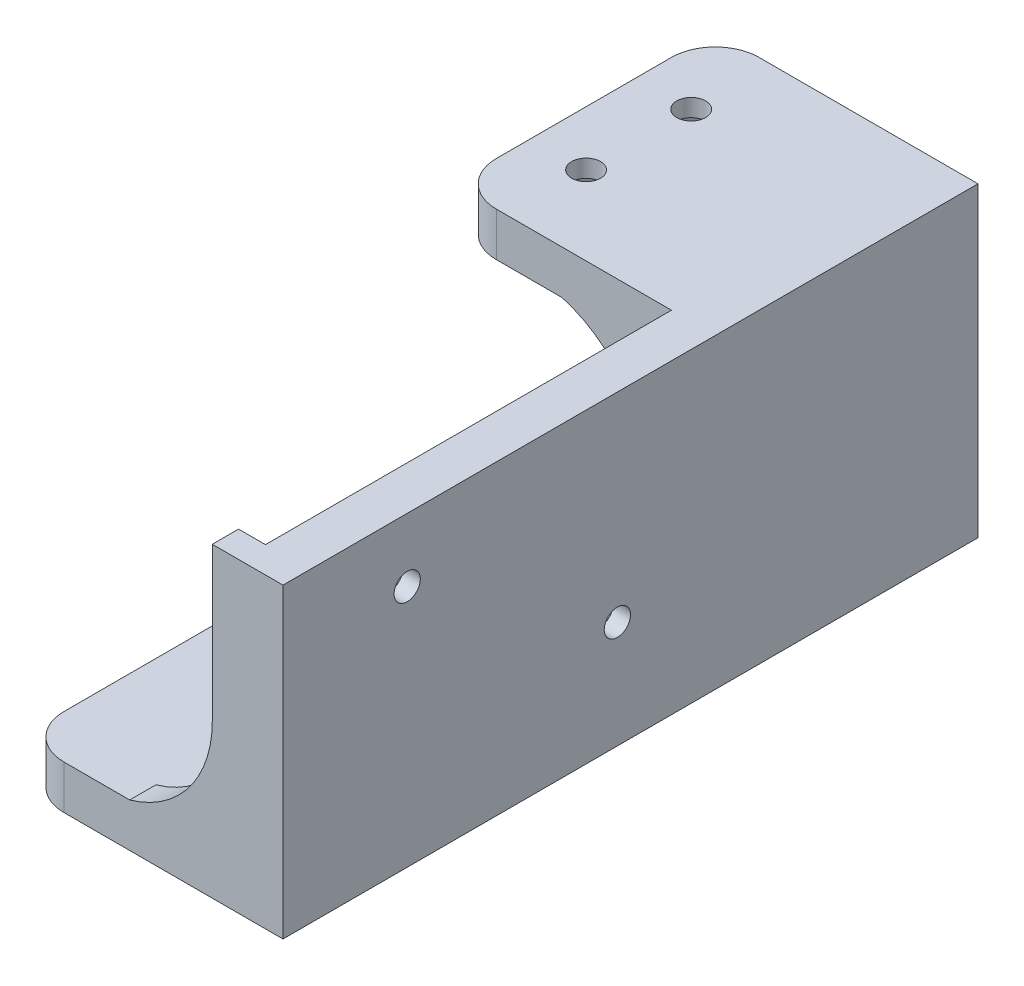
from build123d import *

# Parameters (mm, degrees)
EXTRUDE_1_DEPTH     = 30
EXTRUDE_2_DEPTH     = 3
CUT_EXTRUDE_1_DEPTH = 3
CUT_EXTRUDE_START   = -17
SKETCH_4_R          = 1.65
CUT_EXTRUDE_2_DEPTH = 76
CUT_EXTRUDE_3_DEPTH = 3
FILLET_1_R          = 5
EXTRUDE_3_DEPTH     = 49.36
EXTRUDE_4_DEPTH     = 3
CUT_EXTRUDE_4_DEPTH = 3
SKETCH_10_R         = 1.5
CUT_EXTRUDE_5_DEPTH = 12
FILLET_2_R          = 5
CUT_EXTRUDE_6_DEPTH = 3
SKETCH_12_R         = 1.65
CUT_EXTRUDE_7_DEPTH = 15


with BuildPart() as part:
    # Эскиз1 → Бобышка-Вытянуть1 (new body)
    with BuildSketch(Plane.XY):
        Polygon((0, 0), (30, 0), (30, 35), (0, 35), (0, 30), (25, 30), (25, 5), (0, 5), align=None)
    extrude(amount=EXTRUDE_1_DEPTH)

    # Эскиз2 → Бобышка-Вытянуть2 (add)
    with BuildSketch(Plane.XY.offset(30)):
        with BuildLine():
            Line((12.5, 30), (25, 30))
            Line((25, 30), (25, 5))
            Line((25, 5), (12.5, 5))
            ThreePointArc((12.5, 5), (21.929285786, 17.5), (12.5, 30))
        make_face()
    extrude_2 = extrude(amount=-EXTRUDE_2_DEPTH)

    # Зеркальное отражение1: Бобышка-Вытянуть2 across plane
    add(extrude_2.mirror(Plane.XY.offset(15)))

    # Эскиз3 → Вырез-Вытянуть1 (cut)
    with BuildSketch(Plane(origin=(0, 5, 0), x_dir=(1, 0, 0), z_dir=(0, 1, 0))):
        Polygon((4.517949192, -24), (2.785898385, -21), (4.517949192, -18), (7.982050808, -18), (9.714101615, -21), (7.982050808, -24), align=None)
        Polygon((2.785898385, -9), (4.517949192, -12), (7.982050808, -12), (9.714101615, -9), (7.982050808, -6), (4.517949192, -6), align=None)
    extrude(amount=-CUT_EXTRUDE_1_DEPTH, mode=Mode.SUBTRACT)

    # Эскиз4 → Вырез-Вытянуть2 (cut)
    with BuildSketch(Plane(origin=(0, 2, 0), x_dir=(1, 0, 0), z_dir=(0, 1, 0)).offset(CUT_EXTRUDE_START)):
        with Locations(Location((6.25, -21, 0), (0, 0, 90))):
            Circle(SKETCH_4_R)
    cut_extrude_2 = extrude(amount=CUT_EXTRUDE_2_DEPTH, mode=Mode.SUBTRACT)

    # Зеркальное отражение2: Вырез-Вытянуть2 across plane
    add(cut_extrude_2.mirror(Plane.XY.offset(15)), mode=Mode.SUBTRACT)

    # Эскиз5 → Вырез-Вытянуть3 (cut)
    with BuildSketch(Plane.XZ.offset(-30)):
        Polygon((9.714101615, 21), (7.982050808, 24), (4.517949192, 24), (2.785898385, 21), (4.517949192, 18), (7.982050808, 18), align=None)
    cut_extrude_3 = extrude(amount=-CUT_EXTRUDE_3_DEPTH, mode=Mode.SUBTRACT)

    # Зеркальное отражение3: Вырез-Вытянуть3 across plane
    add(cut_extrude_3.mirror(Plane.XY.offset(15)), mode=Mode.SUBTRACT)

    # Скругление1
    fillet_1_edges = [part.edges().sort_by_distance(p)[0] for p in [
        (0, 2.5, 0),
        (0, 32.5, 30),
        (0, 32.5, 0),
    ]]
    fillet(fillet_1_edges, radius=FILLET_1_R)

    # Эскиз7 → Бобышка-Вытянуть3 (add)
    with BuildSketch(Plane.XY.offset(30)):
        Polygon((0, 0), (30, 0), (30, 35), (25, 35), (25, 5), (0, 5), align=None)
    extrude(amount=EXTRUDE_3_DEPTH)

    # Эскиз8 → Бобышка-Вытянуть4 (add)
    with BuildSketch(Plane.XY.offset(79.36)):
        with BuildLine():
            Line((21.929285786, 17.5), (21.929285786, 35))
            Line((21.929285786, 35), (25, 35))
            Line((25, 35), (25, 5))
            Line((25, 5), (12.5, 5))
            ThreePointArc((12.5, 5), (19.307611392, 9.67118415), (21.929285786, 17.5))
        make_face()
    extrude(amount=-EXTRUDE_4_DEPTH)

    # Эскиз9 → Вырез-Вытянуть4 (cut)
    with BuildSketch(Plane.ZY.offset(-25)):
        Polygon((65.18, 31.229416542), (62.18, 29.497365734), (62.18, 26.033264119), (65.18, 24.301213312), (68.18, 26.033264119), (68.18, 29.497365734), align=None)
        Polygon((41.18, 15.698786688), (38.18, 13.966735881), (38.18, 10.502634266), (41.18, 8.770583458), (44.18, 10.502634266), (44.18, 13.966735881), align=None)
    extrude(amount=-CUT_EXTRUDE_4_DEPTH, mode=Mode.SUBTRACT)

    # Эскиз10 → Вырез-Вытянуть5 (cut)
    with BuildSketch(Plane.ZY.offset(-28)):
        with Locations(Location((41.18, 12.234685073, 0), (0, 0, 270))):
            Circle(SKETCH_10_R)
        with Locations(Location((65.18, 27.765314927, 0), (0, 0, 270))):
            Circle(SKETCH_10_R)
    extrude(amount=-CUT_EXTRUDE_5_DEPTH, mode=Mode.SUBTRACT)

    # Скругление2
    fillet_2_edges = [part.edges().sort_by_distance(p)[0] for p in [
        (0, 2.5, 79.36),
    ]]
    fillet(fillet_2_edges, radius=FILLET_2_R)

    # Эскиз11 → Вырез-Вытянуть6 (cut)
    with BuildSketch(Plane(origin=(0, 5, 0), x_dir=(1, 0, 0), z_dir=(0, 1, 0))):
        Polygon((15.064802613, -64.36), (16.79685342, -67.36), (20.260955035, -67.36), (21.993005843, -64.36), (20.260955035, -61.36), (16.79685342, -61.36), align=None)
        Polygon((9.935197387, -42), (8.20314658, -39), (4.739044965, -39), (3.006994157, -42), (4.739044965, -45), (8.20314658, -45), align=None)
    extrude(amount=-CUT_EXTRUDE_6_DEPTH, mode=Mode.SUBTRACT)

    # Эскиз12 → Вырез-Вытянуть7 (cut)
    with BuildSketch(Plane(origin=(0, 2, 0), x_dir=(1, 0, 0), z_dir=(0, 1, 0))):
        with Locations(Location((6.471095772, -42, 0), (0, 0, 270))):
            Circle(SKETCH_12_R)
        with Locations(Location((18.528904228, -64.36, 0), (0, 0, 270))):
            Circle(SKETCH_12_R)
    extrude(amount=-CUT_EXTRUDE_7_DEPTH, mode=Mode.SUBTRACT)


solid = part.part
